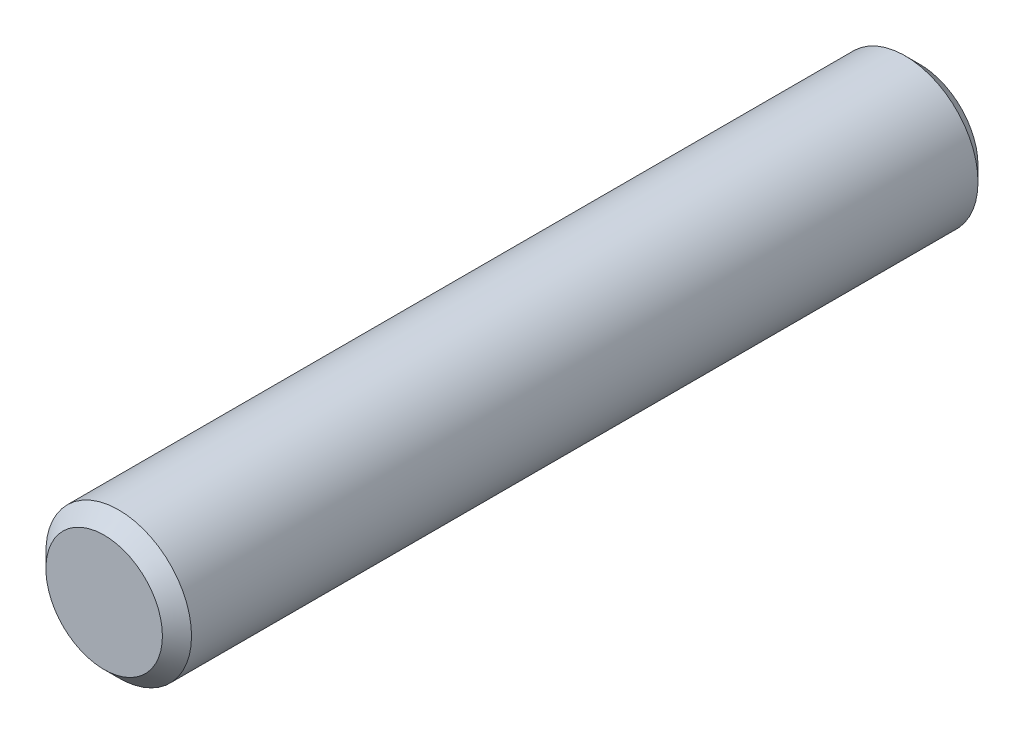
from build123d import *

# Parameters (mm, degrees)
SKETCH1_R           = 2.5
BOSS_EXTRUDE1_DEPTH = 14
CHAMFER1_SIZE       = 0.5


with BuildPart() as part:
    # Sketch1 → Boss-Extrude1 (new, symmetric)
    with BuildSketch(Plane.XY):
        Circle(SKETCH1_R)
    extrude(amount=BOSS_EXTRUDE1_DEPTH, both=True)

    # Chamfer1
    chamfer1_edges = [part.edges().sort_by_distance(p)[0] for p in [
        (-2.5, 0, -14),
        (-2.5, 0, 14),
    ]]
    chamfer(chamfer1_edges, length=CHAMFER1_SIZE)


solid = part.part
